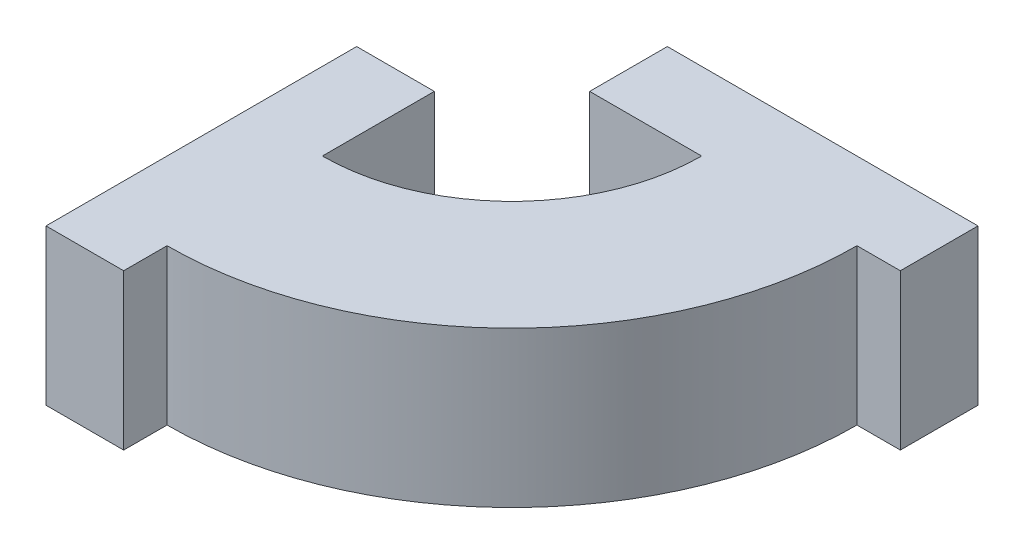
from build123d import *

# Parameters (mm, degrees)
SKETCH2_W           = 1
SKETCH2_H           = 4
SKETCH2_W_2         = 4
SKETCH2_H_2         = 1
BOSS_EXTRUDE1_DEPTH = 2


with BuildPart() as part:
    # Sketch2 → Boss-Extrude1 (new body)
    with BuildSketch(Plane(origin=(0, 0, 0), x_dir=(1, 0, 0), z_dir=(0, 1, 0))):
        with Locations((0.5, -4)):
            Rectangle(SKETCH2_W, SKETCH2_H)
        with BuildLine():
            Line((5.441670533, -1), (3.441670533, -1))
            ThreePointArc((3.441670533, -1), (2.726521791, -2.726521791), (1, -3.441670533))
            Line((1, -3.441670533), (1, -5.441670533))
            ThreePointArc((1, -5.441670533), (4.140735354, -4.140735354), (5.441670533, -1))
        make_face()
        with Locations((4, -0.5)):
            Rectangle(SKETCH2_W_2, SKETCH2_H_2)
    extrude(amount=BOSS_EXTRUDE1_DEPTH)


solid = part.part
